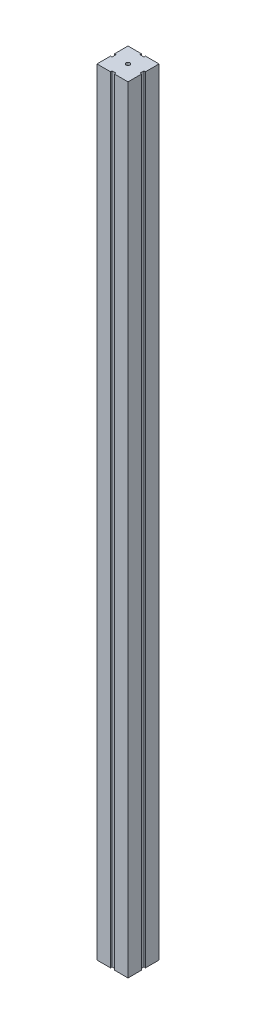
from build123d import *

# Parameters (mm, degrees)
SKETCH1_R           = 3.175
BOSS_EXTRUDE2_DEPTH = 1270


with BuildPart() as part:
    # Sketch1 → Boss-Extrude2 (new body)
    with BuildSketch(Plane(origin=(0, 0, 0), x_dir=(1, 0, 0), z_dir=(0, 1, 0))):
        Polygon((25.4, -3.175), (22.862359133, -3.175), (22.862359133, 3.175), (25.4, 3.175), (25.4, 25.4), (3.175, 25.4), (3.175, 22.862359133), (-3.175, 22.862359133), (-3.175, 25.4), (-25.4, 25.4), (-25.4, 3.175), (-22.862359133, 3.175), (-22.862359133, -3.175), (-25.4, -3.175), (-25.4, -25.4), (-3.175, -25.4), (-3.175, -22.862359133), (3.175, -22.862359133), (3.175, -25.4), (25.4, -25.4), align=None)
        with Locations(Location((0, 0, 0), (0, 0, 90))):
            Circle(SKETCH1_R, mode=Mode.SUBTRACT)
    extrude(amount=BOSS_EXTRUDE2_DEPTH)


solid = part.part
